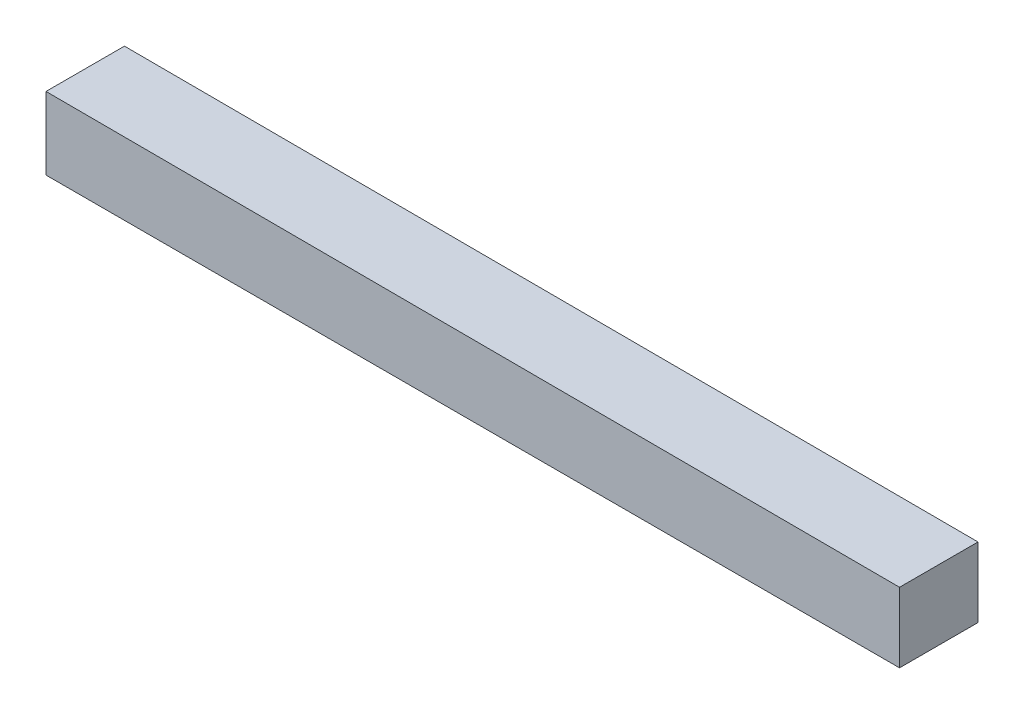
from build123d import *

# Parameters (mm, degrees)
BOSS_EXTRUDE1_DEPTH = 5


with BuildPart() as part:
    # Sketch1 → Boss-Extrude1 (new body)
    with BuildSketch(Plane.XY):
        Polygon((-28.866229571, -4.640368621), (25.523611262, -4.640368621), (25.523611262, -0.191264651), (-28.866229571, -0.023531208), align=None)
    extrude(amount=BOSS_EXTRUDE1_DEPTH)


solid = part.part
